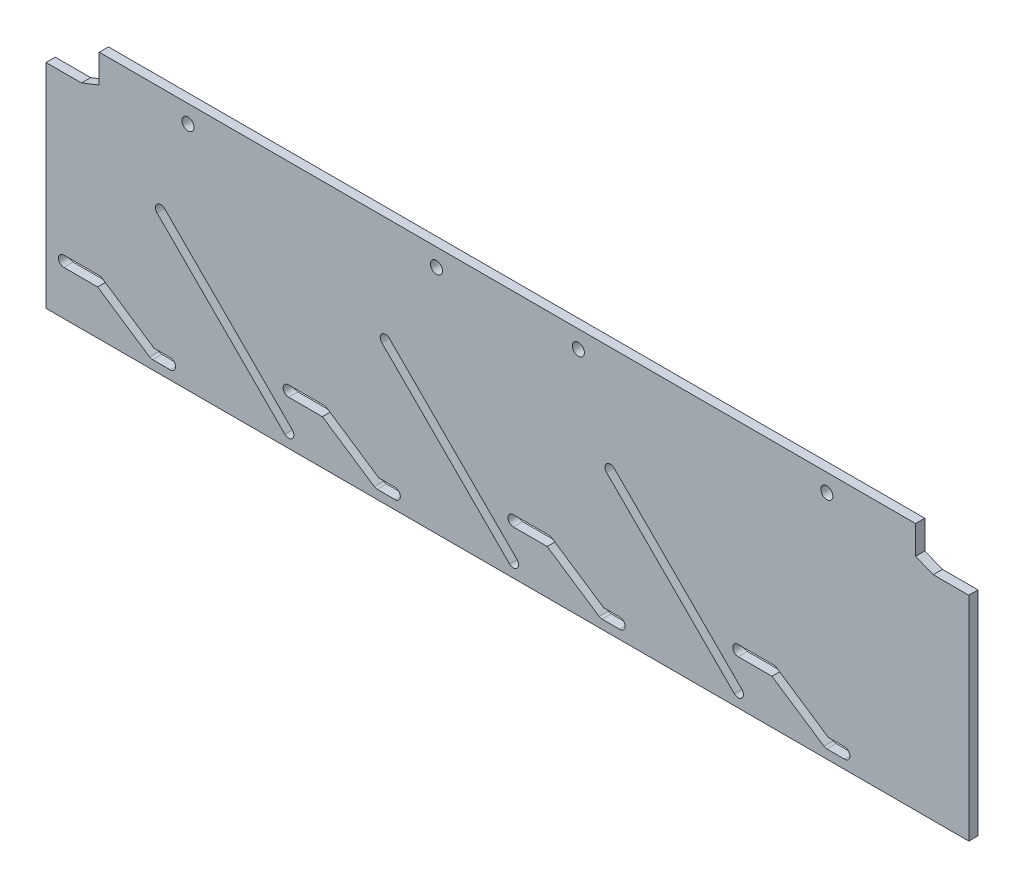
from build123d import *

# Parameters (mm, degrees)
SKETCH_1_W             = 260
SKETCH_1_H             = 70
EXTRUDE_1_DEPTH        = 2.6
SKETCH_2_R             = 1.7
CUT_EXTRUDE_1_DEPTH    = 135.654223848
SKETCH_3_R             = 1.3
CUT_EXTRUDE_2_DEPTH    = 135.654223848
CUT_EXTRUDE_4_DEPTH    = 135.654223848
PATTERN_LINEAR_2_COUNT = 3
PATTERN_LINEAR_2_PITCH = 63.333333333
CUT_EXTRUDE_3_DEPTH    = 135.654223848
PATTERN_LINEAR_1_COUNT = 4
PATTERN_LINEAR_1_PITCH = 63.333333333


with BuildPart() as part:
    # 草图1 → 凸台-拉伸1 (new body)
    with BuildSketch(Plane.XY):
        Rectangle(SKETCH_1_W, SKETCH_1_H)
    extrude(amount=EXTRUDE_1_DEPTH)

    # 草图2 → 切除-拉伸1 (cut, through all)
    with BuildSketch(Plane.XY.offset(2.6)):
        with Locations((-90, 30)):
            Circle(SKETCH_2_R)
        with Locations((-20, 30)):
            Circle(SKETCH_2_R)
        with Locations((20, 30)):
            Circle(SKETCH_2_R)
        with Locations((90, 30)):
            Circle(SKETCH_2_R)
        Polygon((-130, 25), (-130, 35), (-115, 35), (-115, 27), (-120, 25), align=None)
        Polygon((130, 25), (130, 35), (115, 35), (115, 27), (120, 25), align=None)
    extrude(amount=-CUT_EXTRUDE_1_DEPTH, mode=Mode.SUBTRACT)

    # 草图3 → 切除-拉伸2 (cut, through all)
    with BuildSketch(Plane.XY.offset(2.6)):
        with Locations((-61.666666667, -31)):
            Circle(SKETCH_3_R)
        with Locations((1.666666667, -31)):
            Circle(SKETCH_3_R)
        with Locations((65, -31)):
            Circle(SKETCH_3_R)
    extrude(amount=-CUT_EXTRUDE_2_DEPTH, mode=Mode.SUBTRACT)

    # 草图5 → 切除-拉伸4 (cut, through all)
    with BuildSketch(Plane.XY.offset(2.6)):
        with BuildLine():
            Line((-62.727326838, -32.060660172), (-98.727326838, 3.939339828))
            ThreePointArc((-98.727326838, 3.939339828), (-98.727326838, 6.060660172), (-96.606006495, 6.060660172))
            Line((-96.606006495, 6.060660172), (-60.606006495, -29.939339828))
            ThreePointArc((-60.606006495, -29.939339828), (-60.606006495, -32.060660172), (-62.727326838, -32.060660172))
        make_face()
    cut_extrude_4 = extrude(amount=-CUT_EXTRUDE_4_DEPTH, mode=Mode.SUBTRACT)

    # 阵列(线性)2: 切除-拉伸4 ×3
    with Locations(*[(i * PATTERN_LINEAR_2_PITCH, 0, 0) for i in range(1, PATTERN_LINEAR_2_COUNT)]):
        add(cut_extrude_4, mode=Mode.SUBTRACT)

    # 草图4 → 切除-拉伸3 (cut, through all)
    with BuildSketch(Plane.XY.offset(2.6)):
        with BuildLine():
            Line((-125, -19.5), (-115, -19.5))
            ThreePointArc((-115, -19.5), (-114.565323777, -19.56436196), (-114.167949706, -19.751924558))
            Line((-114.167949706, -19.751924558), (-99.545836543, -29.5))
            Line((-99.545836543, -29.5), (-95, -29.5))
            ThreePointArc((-95, -29.5), (-93.5, -31), (-95, -32.5))
            Line((-95, -32.5), (-100, -32.5))
            ThreePointArc((-100, -32.5), (-100.434676223, -32.43563804), (-100.832050294, -32.248075442))
            Line((-100.832050294, -32.248075442), (-115.454163457, -22.5))
            Line((-115.454163457, -22.5), (-125, -22.5))
            ThreePointArc((-125, -22.5), (-126.5, -21), (-125, -19.5))
        make_face()
    cut_extrude_3 = extrude(amount=-CUT_EXTRUDE_3_DEPTH, mode=Mode.SUBTRACT)

    # 阵列(线性)1: 切除-拉伸3 ×4
    with Locations(*[(i * PATTERN_LINEAR_1_PITCH, 0, 0) for i in range(1, PATTERN_LINEAR_1_COUNT)]):
        add(cut_extrude_3, mode=Mode.SUBTRACT)


solid = part.part
